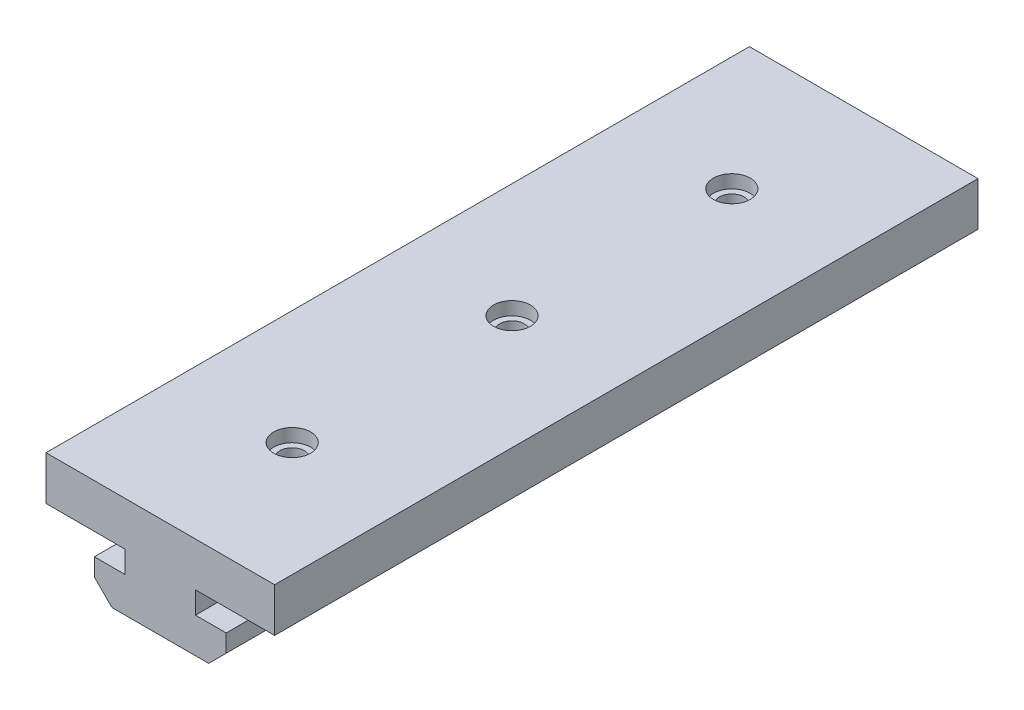
from build123d import *

# Parameters (mm, degrees)
EXTRUDE1_DEPTH                              = 80
CBORE_FOR_M5_HEX_HEAD_CAP_SCREW1_AT_2_COUNT = 2
CBORE_FOR_M5_HEX_HEAD_CAP_SCREW1_AT_2_PITCH = 25
CBORE_FOR_M5_HEX_HEAD_CAP_SCREW1_AT_3_COUNT = 2
CBORE_FOR_M5_HEX_HEAD_CAP_SCREW1_AT_3_PITCH = 50


with BuildPart() as part:
    # Sketch1 → Extrude1 (new body)
    with BuildSketch(Plane.XY):
        Polygon((-13, 0), (-4, 0), (-4, -2.5), (-7.5, -2.5), (-7.5, -4.5), (-5.5, -6.5), (5.5, -6.5), (7.5, -4.5), (7.5, -2.5), (4, -2.5), (4, 0), (13, 0), (13, 5), (-13, 5), align=None)
    extrude(amount=EXTRUDE1_DEPTH)

    # Sketch3 → CBORE for M5 Hex Head Cap Screw1 (revolve, cut)
    with BuildSketch(Plane(origin=(0, 5, 65), x_dir=(0, 0, 1), z_dir=(1, 0, 0))):
        Polygon((0, 0), (0, 11.5), (1.4, 11.5), (2.1, 11.5), (2.1, 10), (1.4, 10), (1.4, 1.5), (2.1, 1.5), (2.1, 0), align=None)
    cbore_for_m5_hex_head_cap_screw1 = revolve(axis=Axis((0, 11.35, 65), (0, -1, 0)), mode=Mode.SUBTRACT)

    # CBORE for M5 Hex Head Cap Screw1 at 2: CBORE for M5 Hex Head Cap Screw1 ×2
    with Locations(*[(0, 0, -i * CBORE_FOR_M5_HEX_HEAD_CAP_SCREW1_AT_2_PITCH) for i in range(1, CBORE_FOR_M5_HEX_HEAD_CAP_SCREW1_AT_2_COUNT)]):
        add(cbore_for_m5_hex_head_cap_screw1, mode=Mode.SUBTRACT)

    # CBORE for M5 Hex Head Cap Screw1 at 3: CBORE for M5 Hex Head Cap Screw1 ×2
    with Locations(*[(0, 0, -i * CBORE_FOR_M5_HEX_HEAD_CAP_SCREW1_AT_3_PITCH) for i in range(1, CBORE_FOR_M5_HEX_HEAD_CAP_SCREW1_AT_3_COUNT)]):
        add(cbore_for_m5_hex_head_cap_screw1, mode=Mode.SUBTRACT)


solid = part.part
